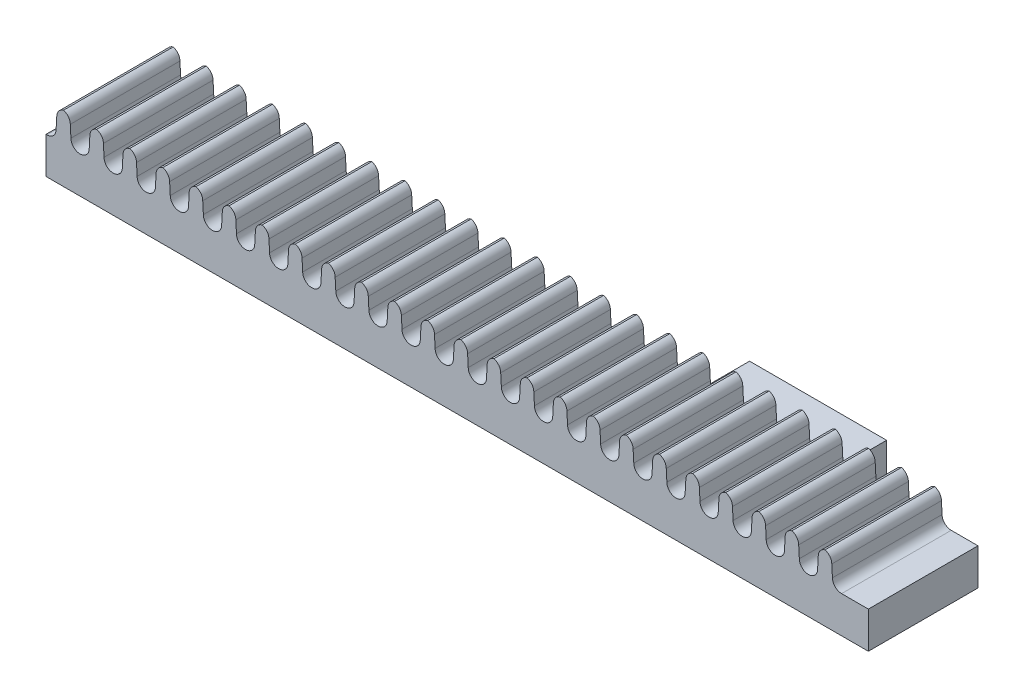
from build123d import *

# Parameters (mm, degrees)
BOSS_EXTRUDE1_DEPTH = 4
BOSS_EXTRUDE3_DEPTH = 12


with BuildPart() as part:
    # Sketch1 → Boss-Extrude1 (new body)
    with BuildSketch(Plane(origin=(0, 0, 0), x_dir=(1, 0, 0), z_dir=(0, 1, 0))):
        Polygon((75, 12), (90, 12), (90, 0), (0, 0), (0, 12), (60, 12), (60, 17), (75, 17), align=None)
    extrude(amount=BOSS_EXTRUDE1_DEPTH)

    # Sketch2 → Boss-Extrude3 (add)
    with BuildSketch(Plane.XY):
        with BuildLine():
            Line((1.10505422, 5), (1.175606581, 6.27259339))
            ThreePointArc((1.175606581, 6.27259339), (1.382253241, 6.881354819), (1.916787536, 7.238519216))
            ThreePointArc((1.916787536, 7.238519216), (2.451321831, 6.881354819), (2.657968491, 6.27259339))
            Line((2.657968491, 6.27259339), (2.728520852, 5))
            ThreePointArc((2.728520852, 5), (3.728520852, 4), (4.728520852, 5))
            Line((4.728520852, 5), (4.799073212, 6.27259339))
            ThreePointArc((4.799073212, 6.27259339), (5.005719872, 6.881354819), (5.540254167, 7.238519216))
            ThreePointArc((5.540254167, 7.238519216), (6.074788462, 6.881354819), (6.281435122, 6.27259339))
            Line((6.281435122, 6.27259339), (6.351987483, 5))
            ThreePointArc((6.351987483, 5), (7.351987483, 4), (8.351987483, 5))
            Line((8.351987483, 5), (8.422539844, 6.27259339))
            ThreePointArc((8.422539844, 6.27259339), (8.629186504, 6.881354819), (9.163720799, 7.238519216))
            ThreePointArc((9.163720799, 7.238519216), (9.698255094, 6.881354819), (9.904901754, 6.27259339))
            Line((9.904901754, 6.27259339), (9.975454114, 5))
            ThreePointArc((9.975454114, 5), (10.975454114, 4), (11.975454114, 5))
            Line((11.975454114, 5), (12.046006475, 6.27259339))
            ThreePointArc((12.046006475, 6.27259339), (12.252653135, 6.881354819), (12.78718743, 7.238519216))
            ThreePointArc((12.78718743, 7.238519216), (13.321721725, 6.881354819), (13.528368385, 6.27259339))
            Line((13.528368385, 6.27259339), (13.598920746, 5))
            ThreePointArc((13.598920746, 5), (14.598920746, 4), (15.598920746, 5))
            Line((15.598920746, 5), (15.669473107, 6.27259339))
            ThreePointArc((15.669473107, 6.27259339), (15.876119766, 6.881354819), (16.410654062, 7.238519216))
            ThreePointArc((16.410654062, 7.238519216), (16.945188357, 6.881354819), (17.151835017, 6.27259339))
            Line((17.151835017, 6.27259339), (17.222387377, 5))
            ThreePointArc((17.222387377, 5), (18.222387377, 4), (19.222387377, 5))
            Line((19.222387377, 5), (19.292939738, 6.27259339))
            ThreePointArc((19.292939738, 6.27259339), (19.499586398, 6.881354819), (20.034120693, 7.238519216))
            ThreePointArc((20.034120693, 7.238519216), (20.568654988, 6.881354819), (20.775301648, 6.27259339))
            Line((20.775301648, 6.27259339), (20.845854009, 5))
            ThreePointArc((20.845854009, 5), (21.845854009, 4), (22.845854009, 5))
            Line((22.845854009, 5), (22.91640637, 6.27259339))
            ThreePointArc((22.91640637, 6.27259339), (23.123053029, 6.881354819), (23.657587324, 7.238519216))
            ThreePointArc((23.657587324, 7.238519216), (24.19212162, 6.881354819), (24.398768279, 6.27259339))
            Line((24.398768279, 6.27259339), (24.46932064, 5))
            ThreePointArc((24.46932064, 5), (25.46932064, 4), (26.46932064, 5))
            Line((26.46932064, 5), (26.539873001, 6.27259339))
            ThreePointArc((26.539873001, 6.27259339), (26.746519661, 6.881354819), (27.281053956, 7.238519216))
            ThreePointArc((27.281053956, 7.238519216), (27.815588251, 6.881354819), (28.022234911, 6.27259339))
            Line((28.022234911, 6.27259339), (28.092787272, 5))
            ThreePointArc((28.092787272, 5), (29.092787272, 4), (30.092787272, 5))
            Line((30.092787272, 5), (30.163339632, 6.27259339))
            ThreePointArc((30.163339632, 6.27259339), (30.369986292, 6.881354819), (30.904520587, 7.238519216))
            ThreePointArc((30.904520587, 7.238519216), (31.439054883, 6.881354819), (31.645701542, 6.27259339))
            Line((31.645701542, 6.27259339), (31.716253903, 5))
            ThreePointArc((31.716253903, 5), (32.716253903, 4), (33.716253903, 5))
            Line((33.716253903, 5), (33.786806264, 6.27259339))
            ThreePointArc((33.786806264, 6.27259339), (33.993452924, 6.881354819), (34.527987219, 7.238519216))
            ThreePointArc((34.527987219, 7.238519216), (35.062521514, 6.881354819), (35.269168174, 6.27259339))
            Line((35.269168174, 6.27259339), (35.339720535, 5))
            ThreePointArc((35.339720535, 5), (36.339720535, 4), (37.339720535, 5))
            Line((37.339720535, 5), (37.410272895, 6.27259339))
            ThreePointArc((37.410272895, 6.27259339), (37.616919555, 6.881354819), (38.15145385, 7.238519216))
            ThreePointArc((38.15145385, 7.238519216), (38.685988145, 6.881354819), (38.892634805, 6.27259339))
            Line((38.892634805, 6.27259339), (38.963187166, 5))
            ThreePointArc((38.963187166, 5), (39.963187166, 4), (40.963187166, 5))
            Line((40.963187166, 5), (41.033739527, 6.27259339))
            ThreePointArc((41.033739527, 6.27259339), (41.240386186, 6.881354819), (41.774920482, 7.238519216))
            ThreePointArc((41.774920482, 7.238519216), (42.309454777, 6.881354819), (42.516101437, 6.27259339))
            Line((42.516101437, 6.27259339), (42.586653797, 5))
            ThreePointArc((42.586653797, 5), (43.586653797, 4), (44.586653797, 5))
            Line((44.586653797, 5), (44.657206158, 6.27259339))
            ThreePointArc((44.657206158, 6.27259339), (44.863852818, 6.881354819), (45.398387113, 7.238519216))
            ThreePointArc((45.398387113, 7.238519216), (45.932921408, 6.881354819), (46.139568068, 6.27259339))
            Line((46.139568068, 6.27259339), (46.210120429, 5))
            ThreePointArc((46.210120429, 5), (47.210120429, 4), (48.210120429, 5))
            Line((48.210120429, 5), (48.28067279, 6.27259339))
            ThreePointArc((48.28067279, 6.27259339), (48.487319449, 6.881354819), (49.021853745, 7.238519216))
            ThreePointArc((49.021853745, 7.238519216), (49.55638804, 6.881354819), (49.763034699, 6.27259339))
            Line((49.763034699, 6.27259339), (49.83358706, 5))
            ThreePointArc((49.83358706, 5), (50.83358706, 4), (51.83358706, 5))
            Line((51.83358706, 5), (51.904139421, 6.27259339))
            ThreePointArc((51.904139421, 6.27259339), (52.110786081, 6.881354819), (52.645320376, 7.238519216))
            ThreePointArc((52.645320376, 7.238519216), (53.179854671, 6.881354819), (53.386501331, 6.27259339))
            Line((53.386501331, 6.27259339), (53.457053692, 5))
            ThreePointArc((53.457053692, 5), (54.457053692, 4), (55.457053692, 5))
            Line((55.457053692, 5), (55.527606052, 6.27259339))
            ThreePointArc((55.527606052, 6.27259339), (55.734252712, 6.881354819), (56.268787007, 7.238519216))
            ThreePointArc((56.268787007, 7.238519216), (56.803321303, 6.881354819), (57.009967962, 6.27259339))
            Line((57.009967962, 6.27259339), (57.080520323, 5))
            ThreePointArc((57.080520323, 5), (58.080520323, 4), (59.080520323, 5))
            Line((59.080520323, 5), (59.151072684, 6.27259339))
            ThreePointArc((59.151072684, 6.27259339), (59.357719344, 6.881354819), (59.892253639, 7.238519216))
            ThreePointArc((59.892253639, 7.238519216), (60.426787934, 6.881354819), (60.633434594, 6.27259339))
            Line((60.633434594, 6.27259339), (60.703986955, 5))
            ThreePointArc((60.703986955, 5), (61.703986955, 4), (62.703986955, 5))
            Line((62.703986955, 5), (62.774539315, 6.27259339))
            ThreePointArc((62.774539315, 6.27259339), (62.981185975, 6.881354819), (63.51572027, 7.238519216))
            ThreePointArc((63.51572027, 7.238519216), (64.050254565, 6.881354819), (64.256901225, 6.27259339))
            Line((64.256901225, 6.27259339), (64.327453586, 5))
            ThreePointArc((64.327453586, 5), (65.327453586, 4), (66.327453586, 5))
            Line((66.327453586, 5), (66.398005947, 6.27259339))
            ThreePointArc((66.398005947, 6.27259339), (66.604652607, 6.881354819), (67.139186902, 7.238519216))
            ThreePointArc((67.139186902, 7.238519216), (67.673721197, 6.881354819), (67.880367857, 6.27259339))
            Line((67.880367857, 6.27259339), (67.950920217, 5))
            ThreePointArc((67.950920217, 5), (68.950920217, 4), (69.950920217, 5))
            Line((69.950920217, 5), (70.021472578, 6.27259339))
            ThreePointArc((70.021472578, 6.27259339), (70.228119238, 6.881354819), (70.762653533, 7.238519216))
            ThreePointArc((70.762653533, 7.238519216), (71.297187828, 6.881354819), (71.503834488, 6.27259339))
            Line((71.503834488, 6.27259339), (71.574386849, 5))
            ThreePointArc((71.574386849, 5), (72.574386849, 4), (73.574386849, 5))
            Line((73.574386849, 5), (73.64493921, 6.27259339))
            ThreePointArc((73.64493921, 6.27259339), (73.851585869, 6.881354819), (74.386120165, 7.238519216))
            ThreePointArc((74.386120165, 7.238519216), (74.92065446, 6.881354819), (75.127301119, 6.27259339))
            Line((75.127301119, 6.27259339), (75.19785348, 5))
            ThreePointArc((75.19785348, 5), (76.19785348, 4), (77.19785348, 5))
            Line((77.19785348, 5), (77.268405841, 6.27259339))
            ThreePointArc((77.268405841, 6.27259339), (77.475052501, 6.881354819), (78.009586796, 7.238519216))
            ThreePointArc((78.009586796, 7.238519216), (78.544121091, 6.881354819), (78.750767751, 6.27259339))
            Line((78.750767751, 6.27259339), (78.821320112, 5))
            ThreePointArc((78.821320112, 5), (79.821320112, 4), (80.821320112, 5))
            Line((80.821320112, 5), (80.891872473, 6.27259339))
            ThreePointArc((80.891872473, 6.27259339), (81.098519132, 6.881354819), (81.633053427, 7.238519216))
            ThreePointArc((81.633053427, 7.238519216), (82.167587723, 6.881354819), (82.374234382, 6.27259339))
            Line((82.374234382, 6.27259339), (82.444786743, 5))
            ThreePointArc((82.444786743, 5), (83.444786743, 4), (84.444786743, 5))
            Line((84.444786743, 5), (84.515339104, 6.27259339))
            ThreePointArc((84.515339104, 6.27259339), (84.721985764, 6.881354819), (85.256520059, 7.238519216))
            ThreePointArc((85.256520059, 7.238519216), (85.791054354, 6.881354819), (85.997701014, 6.27259339))
            Line((85.997701014, 6.27259339), (86.068253375, 5))
            ThreePointArc((86.068253375, 5), (86.361146593, 4.292893219), (87.068253375, 4))
            Line((87.068253375, 4), (87.068253375, 1.902319502))
            Line((87.068253375, 1.902319502), (0.10505422, 2.313670855))
            Line((0.10505422, 2.313670855), (0.10505422, 4))
            ThreePointArc((0.10505422, 4), (0.812161001, 4.292893219), (1.10505422, 5))
        make_face()
    extrude(amount=-BOSS_EXTRUDE3_DEPTH)


solid = part.part
